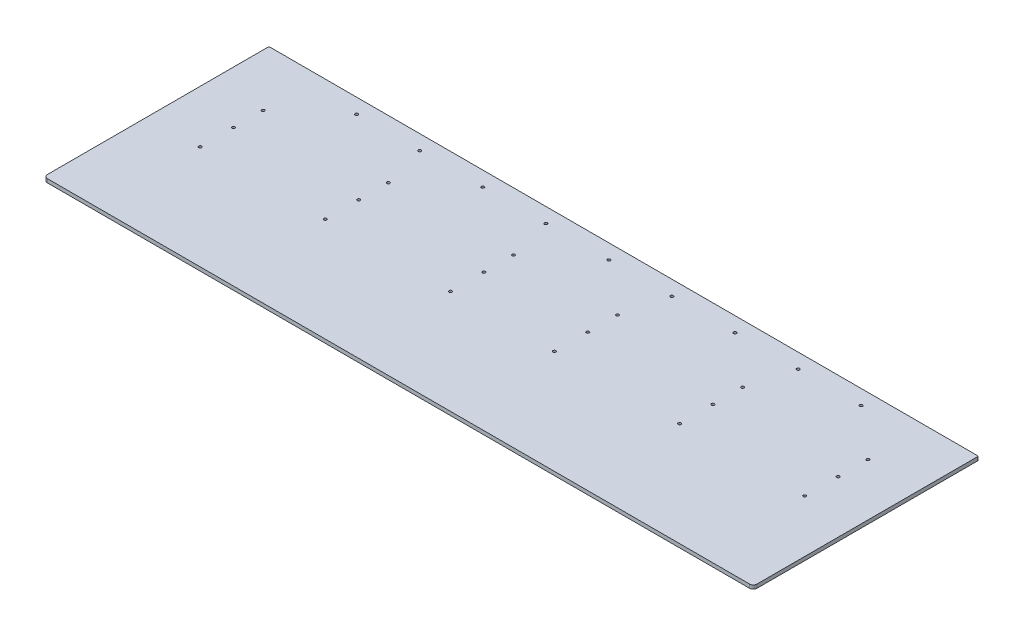
from build123d import *

# Parameters (mm, degrees)
SKETCH1_W                    = 1219.2
SKETCH1_H                    = 366.776
BOSS_EXTRUDE1_DEPTH          = 6.35
F_10_0_1935_DIAMETER_HOLE1_D = 4.9149
SKETCH4_W                    = 1219.2
SKETCH4_H                    = 6.35
CUT_EXTRUDE1_DEPTH           = 1274.190322252
SKETCH5_W                    = 2.38125
SKETCH5_H                    = 360.426
CUT_EXTRUDE2_DEPTH           = 1272.375579432
FILLET1_R                    = 1.27
BOSS_EXTRUDE2_START          = -6.35
SKETCH6_R                    = 2.45745
BOSS_EXTRUDE2_DEPTH          = 6.35
F_10_0_1935_DIAMETER_HOLE2_D = 4.9149
SKETCH9_W                    = 1214.4375
SKETCH9_H                    = 24.9936
BOSS_EXTRUDE3_DEPTH          = 6.35
FILLET2_R                    = 6.35


with BuildPart() as part:
    # Sketch1 → Boss-Extrude1 (new body)
    with BuildSketch(Plane(origin=(0, 0, 0), x_dir=(1, 0, 0), z_dir=(0, 1, 0))):
        with Locations((609.6, 183.388)):
            Rectangle(SKETCH1_W, SKETCH1_H)
    extrude(amount=BOSS_EXTRUDE1_DEPTH)

    # #10 (0.1935) Diameter Hole1 (through all)
    with Locations(Plane(origin=(0, 6.35, 0), x_dir=(1, 0, 0), z_dir=(0, 1, 0))):
        with Locations((177.8, 335.026), (285.75, 335.026), (393.7, 335.026), (501.65, 335.026), (609.6, 335.026), (717.55, 335.026), (139.7, 289.7505), (609.6, 289.7505), (1079.5, 289.7505), (609.6, 238.9505), (1079.5, 238.9505), (609.6, 188.1505), (1079.5, 188.1505), (609.6, 137.3505), (1079.5, 137.3505), (139.7, 238.9505), (139.7, 188.1505), (139.7, 137.3505), (825.5, 335.026), (933.45, 335.026), (1041.4, 335.026)):
            Hole(F_10_0_1935_DIAMETER_HOLE1_D / 2)

    # Sketch4 → Cut-Extrude1 (cut, through all)
    with BuildSketch(Plane(origin=(0, 6.35, 0), x_dir=(1, 0, 0), z_dir=(0, 1, 0))):
        with Locations((609.6, 363.601)):
            Rectangle(SKETCH4_W, SKETCH4_H)
    extrude(amount=-CUT_EXTRUDE1_DEPTH, mode=Mode.SUBTRACT)

    # Sketch5 → Cut-Extrude2 (cut, through all)
    with BuildSketch(Plane(origin=(0, 6.35, 0), x_dir=(1, 0, 0), z_dir=(0, 1, 0))):
        with Locations((1218.009375, 180.213)):
            Rectangle(SKETCH5_W, SKETCH5_H)
        with Locations((1.190625, 180.213)):
            Rectangle(SKETCH5_W, SKETCH5_H)
    extrude(amount=-CUT_EXTRUDE2_DEPTH, mode=Mode.SUBTRACT)

    # Fillet1
    fillet1_edges = [part.edges().sort_by_distance(p)[0] for p in [
        (2.38125, 3.175, -360.426),
        (1216.81875, 3.175, -360.426),
    ]]
    fillet(fillet1_edges, radius=FILLET1_R)

    # Sketch6 → Boss-Extrude2 (add)
    with BuildSketch(Plane(origin=(0, 6.35, 0), x_dir=(1, 0, 0), z_dir=(0, 1, 0)).offset(BOSS_EXTRUDE2_START)):
        with Locations((1079.5, 137.3505)):
            Circle(SKETCH6_R)
        with Locations((1079.5, 188.1505)):
            Circle(SKETCH6_R)
        with Locations((1079.5, 238.9505)):
            Circle(SKETCH6_R)
        with Locations((1079.5, 289.7505)):
            Circle(SKETCH6_R)
        with Locations((609.6, 137.3505)):
            Circle(SKETCH6_R)
        with Locations((609.6, 188.1505)):
            Circle(SKETCH6_R)
        with Locations((609.6, 238.9505)):
            Circle(SKETCH6_R)
        with Locations((609.6, 289.7505)):
            Circle(SKETCH6_R)
        with Locations((139.7, 137.3505)):
            Circle(SKETCH6_R)
        with Locations((139.7, 188.1505)):
            Circle(SKETCH6_R)
        with Locations((139.7, 238.9505)):
            Circle(SKETCH6_R)
        with Locations((139.7, 289.7505)):
            Circle(SKETCH6_R)
    extrude(amount=BOSS_EXTRUDE2_DEPTH)

    # #10 (0.1935) Diameter Hole2 (through all)
    with Locations(Plane(origin=(0, 6.35, 0), x_dir=(1, 0, 0), z_dir=(0, 1, 0))):
        with Locations((92.075, 260.7564), (92.075, 209.9564), (92.075, 152.8064), (306.3875, 260.7564), (306.3875, 209.9564), (306.3875, 152.8064), (520.7, 152.8064), (520.7, 209.9564), (520.7, 260.7564), (698.5, 260.7564), (698.5, 209.9564), (698.5, 152.8064), (912.8125, 152.8064), (912.8125, 209.9564), (912.8125, 260.7564), (1127.125, 152.8064), (1127.125, 209.9564), (1127.125, 260.7564)):
            Hole(F_10_0_1935_DIAMETER_HOLE2_D / 2)

    # Sketch9 → Boss-Extrude3 (add)
    with BuildSketch(Plane(origin=(0, 6.35, 0), x_dir=(1, 0, 0), z_dir=(0, 1, 0))):
        with Locations((609.6, -12.4968)):
            Rectangle(SKETCH9_W, SKETCH9_H)
    extrude(amount=-BOSS_EXTRUDE3_DEPTH)

    # Fillet2
    fillet2_edges = [part.edges().sort_by_distance(p)[0] for p in [
        (1216.81875, 3.175, 24.9936),
        (2.38125, 3.175, 24.9936),
    ]]
    fillet(fillet2_edges, radius=FILLET2_R)


solid = part.part
